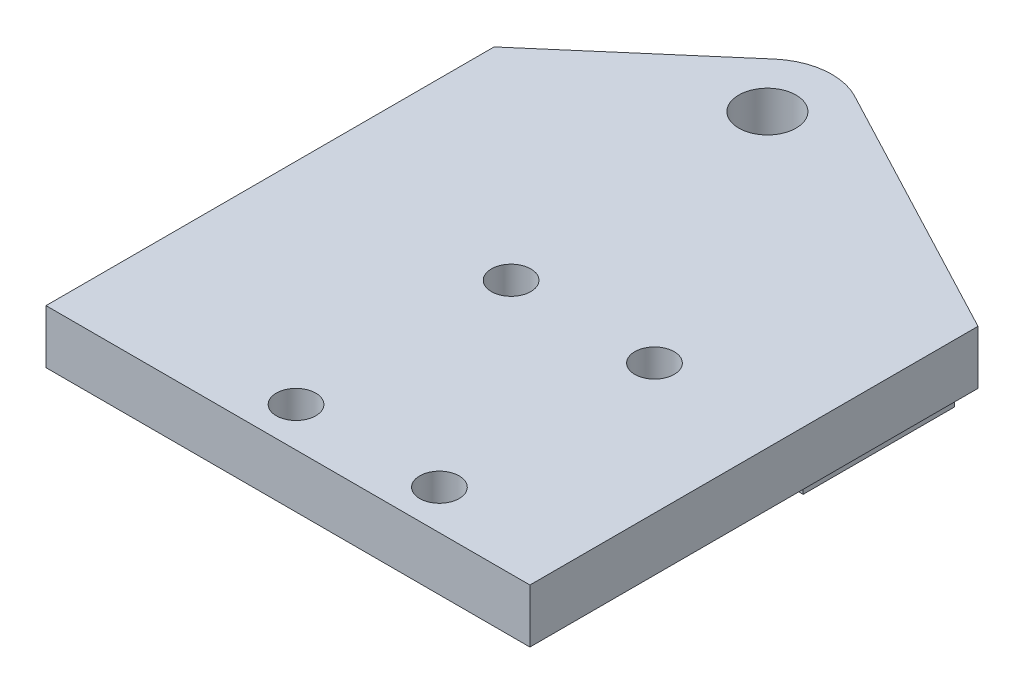
from build123d import *
from build123d.topology import SkipClean

# Parameters (mm, degrees)
SKETCH_2_R      = 1.1
SKETCH_2_R_2    = 1.6
EXTRUDE_1_DEPTH = 3
EXTRUDE_START   = 3
SKETCH_3_R      = 1.6
EXTRUDE_2_DEPTH = 3


with BuildPart() as part:
    # 草图2 → 凸台-拉伸1 (new body)
    with BuildSketch(Plane(origin=(0, 0, 0), x_dir=(1, 0, 0), z_dir=(0, 1, 0))):
        with BuildLine():
            Line((-4.5, 0), (22.5, 0))
            Line((22.5, 0), (22.5, 25))
            Line((22.5, 25), (7.92934595, 32.684304819))
            ThreePointArc((7.92934595, 32.684304819), (5.845539262, 33.077207222), (3.902064927, 32.228956008))
            Line((3.902064927, 32.228956008), (-4.5, 25))
            Line((-4.5, 25), (-4.5, 0))
        make_face()
        with Locations(Location((7.25, 14.2, 0), (0, 0, 270))):
            Circle(SKETCH_2_R, mode=Mode.SUBTRACT)
        with Locations(Location((15.25, 14.2, 0), (0, 0, 90))):
            Circle(SKETCH_2_R, mode=Mode.SUBTRACT)
        with Locations(Location((15.25, 2.2, 0), (0, 0, 270))):
            Circle(SKETCH_2_R, mode=Mode.SUBTRACT)
        with Locations(Location((7.25, 2.2, 0), (0, 0, 90))):
            Circle(SKETCH_2_R, mode=Mode.SUBTRACT)
        with Locations(Location((6.25, 29.5, 0), (0, 0, 270))):
            Circle(SKETCH_2_R_2, mode=Mode.SUBTRACT)
    extrude(amount=EXTRUDE_1_DEPTH)

    # 草图3 → 凸台-拉伸2 (add)
    with SkipClean():  # the faces are left unmerged after this step: merging them gives an invalid solid
        with BuildSketch(Plane.XZ.offset(EXTRUDE_START)):
            with BuildLine():
                Line((19.744057368, -26.453435321), (7.92934595, -32.684304819))
                ThreePointArc((7.92934595, -32.684304819), (5.845539262, -33.077207222), (3.902064927, -32.228956008))
                Line((3.902064927, -32.228956008), (1.744057368, -30.372252704))
                Line((1.744057368, -30.372252704), (1.744057368, -18))
                Line((1.744057368, -18), (19.744057368, -18))
                Line((19.744057368, -18), (19.744057368, -26.453435321))
            make_face()
            with Locations(Location((6.25, -29.5, 0), (0, 0, 270))):
                Circle(SKETCH_3_R, mode=Mode.SUBTRACT)
        extrude(amount=-EXTRUDE_2_DEPTH)


solid = part.part
